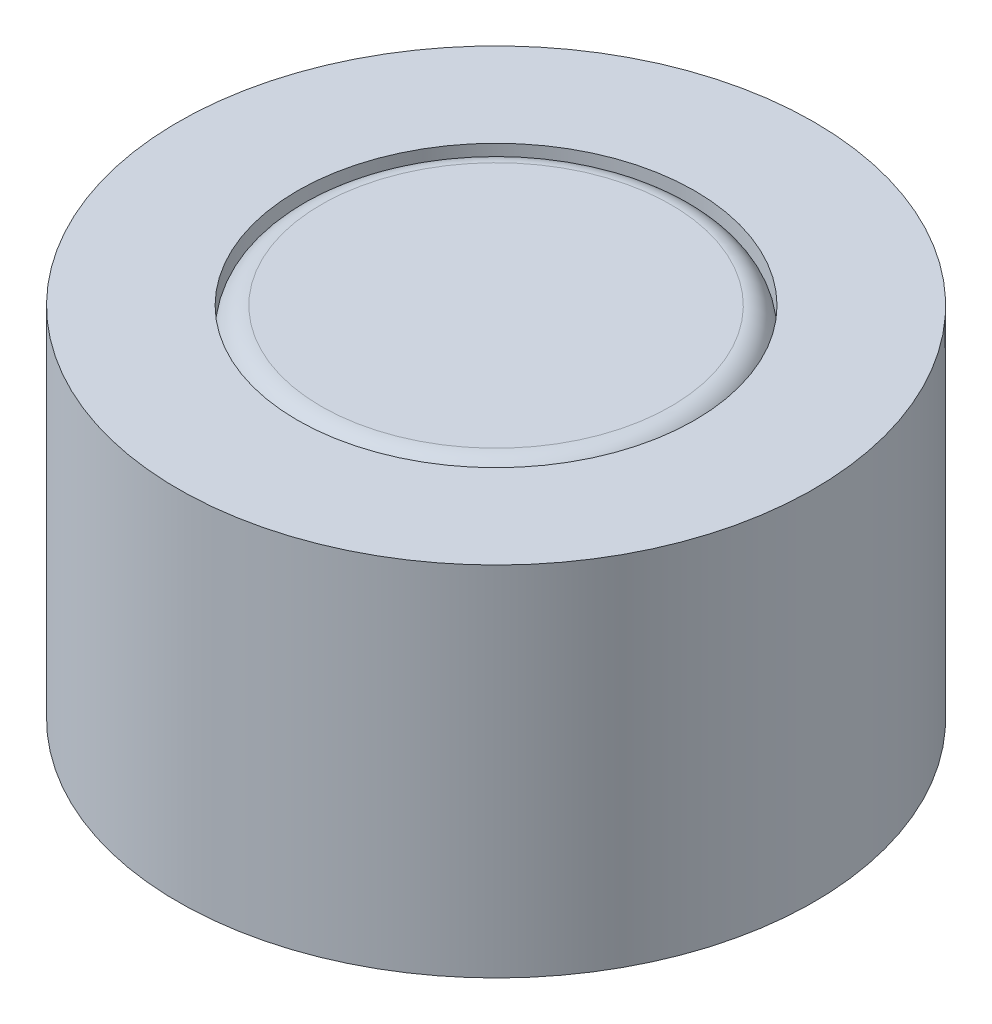
from build123d import *

# Parameters (mm, degrees)
SKETCH_2_W = 2.5
SKETCH_2_H = 3
FILLET_1_R = 0.3


with BuildPart() as part:
    # 草图1 → 旋转1 (revolve)
    with BuildSketch(Plane.XY, mode=Mode.PRIVATE) as revolve_1_sk:
        Polygon((2.025, 0), (2.025, 1.5), (2.5, 1.5), (2.5, 4.5), (4, 4.5), (4, 0), align=None)
    revolve(revolve_1_sk.sketch.rotate(Axis((0, 0, 0), (0, 1, 0)), 90), axis=Axis((0, 0, 0), (0, 1, 0)))


with BuildPart() as body_2:
    # 草图2 → 旋转2 (revolve)
    with BuildSketch(Plane.XY):
        with Locations((1.25, 3)):
            Rectangle(SKETCH_2_W, SKETCH_2_H)
    revolve(axis=Axis((0, 0, 0), (0, 1, 0)))

    # 圆角1
    fillet_1_edges = [body_2.edges().sort_by_distance(p)[0] for p in [
        (-2.5, 4.5, 0),
        (-2.5, 1.5, 0),
    ]]
    fillet(fillet_1_edges, radius=FILLET_1_R)


solid = Compound([part.part, body_2.part])
